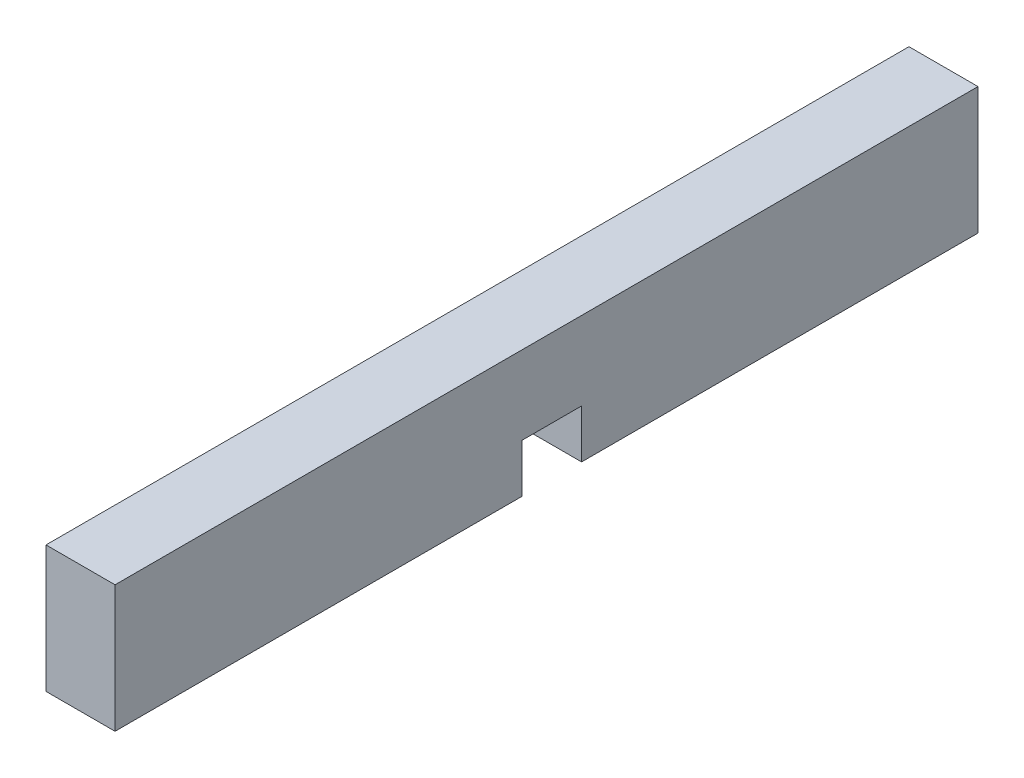
from build123d import *

# Parameters (mm, degrees)
SKETCH1_W           = 58.7248
SKETCH1_H           = 8.636
BOSS_EXTRUDE1_DEPTH = 2.3495
SKETCH2_W           = 4.064
SKETCH2_H           = 3.302
CUT_EXTRUDE2_DEPTH  = 58.2295


with BuildPart() as part:
    # Sketch1 → Boss-Extrude1 (new, symmetric)
    with BuildSketch(Plane(origin=(0, 0, 0), x_dir=(0, 0, -1), z_dir=(1, 0, 0))):
        Rectangle(SKETCH1_W, SKETCH1_H)
    extrude(amount=BOSS_EXTRUDE1_DEPTH, both=True)

    # Sketch2 → Cut-Extrude2 (cut, symmetric)
    with BuildSketch(Plane(origin=(0, 0, 0), x_dir=(0, 0, -1), z_dir=(1, 0, 0))):
        with Locations((0.3556, -2.667)):
            Rectangle(SKETCH2_W, SKETCH2_H)
    extrude(amount=CUT_EXTRUDE2_DEPTH, both=True, mode=Mode.SUBTRACT)


solid = part.part
